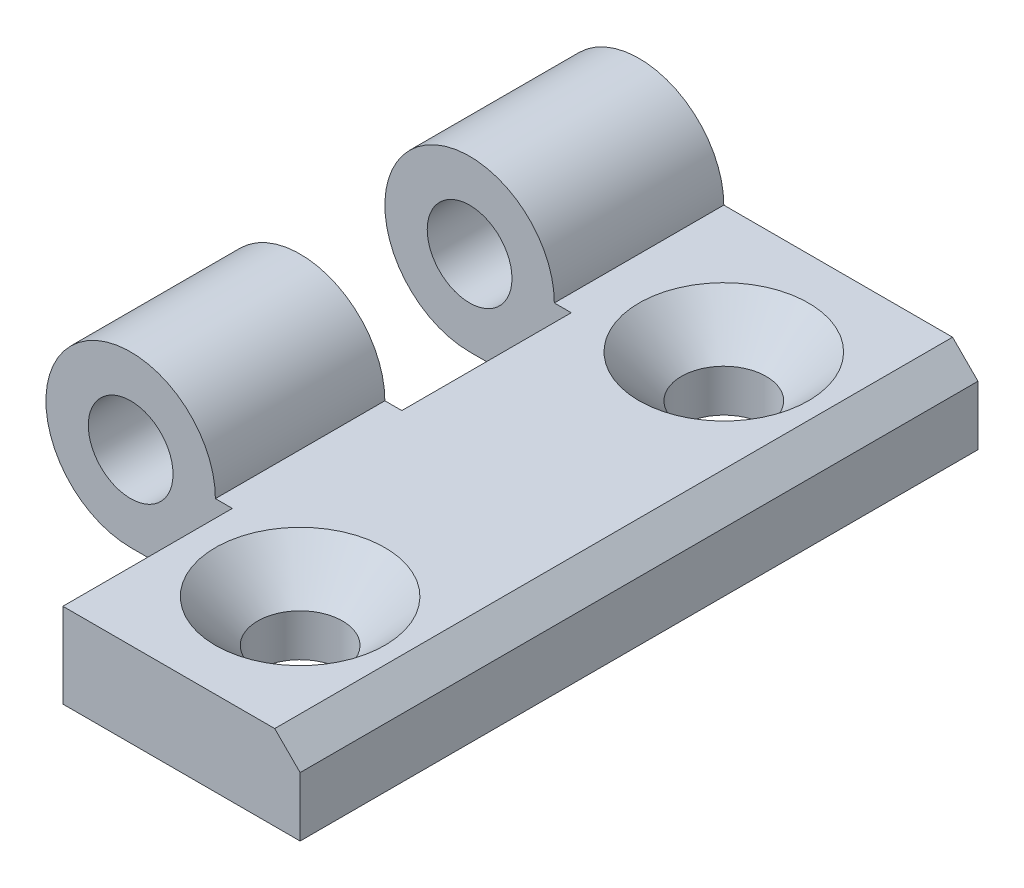
from build123d import *

# Parameters (mm, degrees)
SKETCH_1_W                = 14
SKETCH_1_H                = 5
EXTRUDE_1_DEPTH           = 40
SKETCH_3_R                = 2.5
EXTRUDE_2_DEPTH           = 40
CUT_EXTRUDE_1_DEPTH       = 10
PATTERN_LINEAR_1_COUNT    = 2
PATTERN_LINEAR_1_PITCH    = 20
HOLE_WIZARD_1_D           = 5
HOLE_WIZARD_1_CSINK_D     = 10
HOLE_WIZARD_1_CSINK_ANGLE = 90
CHAMFER_2_SIZE            = 1.5


with BuildPart() as part:
    # 草图1 → 凸台-拉伸1 (new body)
    with BuildSketch(Plane.XY):
        Rectangle(SKETCH_1_W, SKETCH_1_H)
    extrude(amount=EXTRUDE_1_DEPTH)

    # 草图3 → 凸台-拉伸2 (add)
    with BuildSketch(Plane(origin=(0, 0, 0), x_dir=(-1, 0, 0), z_dir=(0, 0, -1))):
        with BuildLine():
            Line((8, 2.5), (7, 2.5))
            Line((7, 2.5), (7, -2.5))
            Line((7, -2.5), (13, -2.5))
            ThreePointArc((13, -2.5), (16.535533906, 6.035533906), (8, 2.5))
        make_face()
        with Locations((13, 2.5)):
            Circle(SKETCH_3_R, mode=Mode.SUBTRACT)
    extrude(amount=-EXTRUDE_2_DEPTH)

    # 草图4 → 切除-拉伸1 (cut)
    with BuildSketch(Plane.XY.offset(40)):
        Polygon((-7, 2.5), (-7, 10.867672428), (-20.063850781, 10.867672428), (-20.063850781, -3.934204251), (-7, -3.934204251), align=None)
    cut_extrude_1 = extrude(amount=-CUT_EXTRUDE_1_DEPTH, mode=Mode.SUBTRACT)

    # 阵列(线性)1: 切除-拉伸1 ×2
    with Locations(*[(0, 0, -i * PATTERN_LINEAR_1_PITCH) for i in range(1, PATTERN_LINEAR_1_COUNT)]):
        add(cut_extrude_1, mode=Mode.SUBTRACT)

    # 打孔尺寸(%根据十字)槽半沉头木螺钉的类型1 (through all)
    with Locations(Plane(origin=(0, 2.5, 0), x_dir=(1, 0, 0), z_dir=(0, 1, 0))):
        with Locations((-0.5, -32.5), (-0.5, -7.5)):
            CounterSinkHole(HOLE_WIZARD_1_D / 2, HOLE_WIZARD_1_CSINK_D / 2, counter_sink_angle=HOLE_WIZARD_1_CSINK_ANGLE)

    # 倒角2
    chamfer_2_edges = [part.edges().sort_by_distance(p)[0] for p in [
        (7, 2.5, 20),
    ]]
    chamfer(chamfer_2_edges, length=CHAMFER_2_SIZE)


solid = part.part
